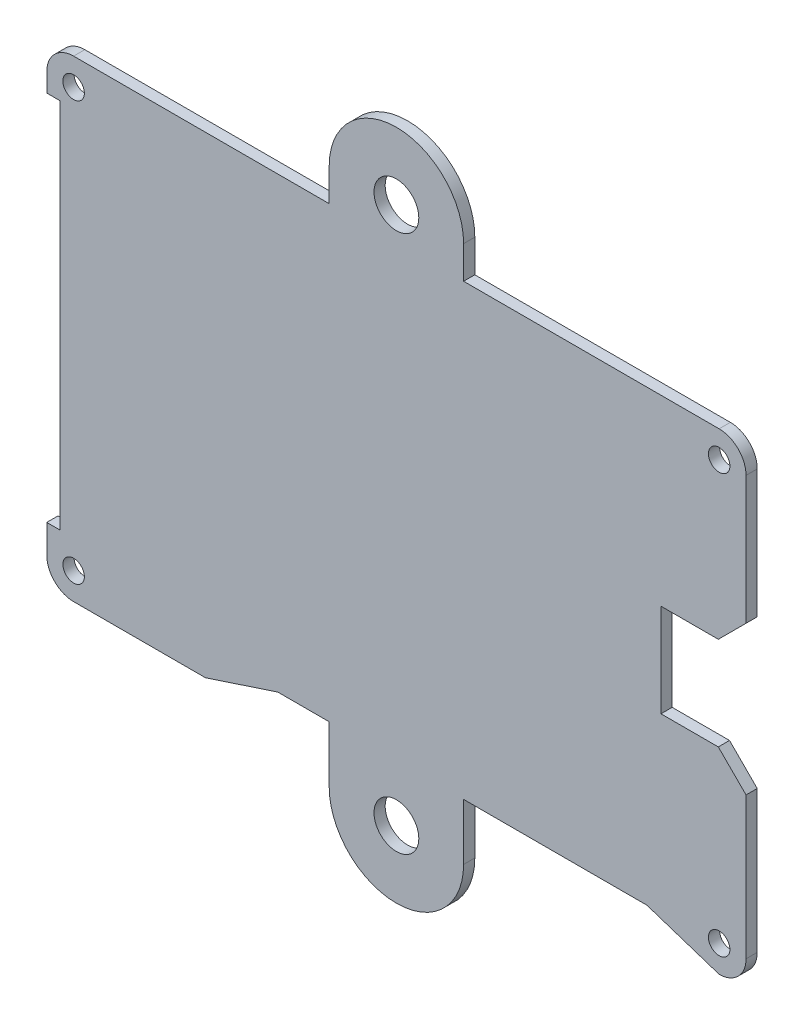
from build123d import *

# Parameters (mm, degrees)
SKETCH1_R           = 1.355900406
BOSS_EXTRUDE1_DEPTH = 1.5875
SKETCH2_R           = 3.175
BOSS_EXTRUDE2_DEPTH = 1.5875
SKETCH3_R           = 1.524
CUT_EXTRUDE1_DEPTH  = 436.184338179
SKETCH5_W           = 2.10299656
SKETCH5_H           = 13.208
BOSS_EXTRUDE3_DEPTH = 1.5875


with BuildPart() as part:
    # Sketch1 → Boss-Extrude1 (new body)
    with BuildSketch(Plane.XY):
        with BuildLine():
            Line((-301.9473, 111.74645), (-305.87795, 115.6771))
            Line((-305.87795, 115.6771), (-316.1078, 115.6771))
            Line((-316.1078, 115.6771), (-316.1078, 128.8851))
            Line((-316.1078, 128.8851), (-305.87795, 128.8851))
            Line((-305.87795, 128.8851), (-301.9473, 132.81575))
            Line((-301.9473, 132.81575), (-301.9473, 150.9704))
            ThreePointArc((-301.9473, 150.9704), (-303.063223164, 153.664476836), (-305.7573, 154.7804))
            Line((-305.7573, 154.7804), (-397.247125, 154.7804))
            ThreePointArc((-397.247125, 154.7804), (-399.946077222, 153.659592612), (-401.0571, 150.956597849))
            Line((-401.0571, 150.956597849), (-401.0571, 148.341))
            Line((-401.0571, 148.341), (-399.1521, 148.341))
            Line((-399.1521, 148.341), (-399.1521, 95.6449))
            Line((-399.1521, 95.6449), (-401.0571, 95.6449))
            Line((-401.0571, 95.6449), (-401.0571, 91.659304166))
            ThreePointArc((-401.0571, 91.659304166), (-399.951018769, 88.947400452), (-397.2472, 87.8217))
            Line((-397.2472, 87.8217), (-378.5565, 87.8217))
            Line((-378.5565, 87.8217), (-368.3165, 91.1883))
            Line((-368.3165, 91.1883), (-315.9973, 91.1883))
            Line((-315.9973, 91.1883), (-305.7573, 87.8217))
            ThreePointArc((-305.7573, 87.8217), (-303.063223164, 88.937623164), (-301.9473, 91.6317))
            Line((-301.9473, 91.6317), (-301.9473, 111.74645))
        make_face()
        with Locations((-305.7573, 91.6317)):
            Circle(SKETCH1_R, mode=Mode.SUBTRACT)
        with Locations((-305.7573, 150.9704)):
            Circle(SKETCH1_R, mode=Mode.SUBTRACT)
        with Locations((-397.247125, 150.9704)):
            Circle(SKETCH1_R, mode=Mode.SUBTRACT)
        with Locations((-397.2472, 91.6317)):
            Circle(SKETCH1_R, mode=Mode.SUBTRACT)
    extrude(amount=BOSS_EXTRUDE1_DEPTH)

    # Sketch2 → Boss-Extrude2 (add)
    # profile 1 of 2: a face of its own
    with BuildSketch(Plane.XY.offset(1.5875)):
        with BuildLine():
            Line((-361.0272, 159.40105), (-361.0272, 154.7804))
            Line((-361.0272, 154.7804), (-341.9772, 154.7804))
            Line((-341.9772, 154.7804), (-341.9772, 159.40105))
            ThreePointArc((-341.9772, 159.40105), (-351.5022, 168.92605), (-361.0272, 159.40105))
        make_face()
        with Locations((-351.5022, 159.40105)):
            Circle(SKETCH2_R, mode=Mode.SUBTRACT)
    # profile 2 of 2: a face of its own
    with BuildSketch(Plane.XY.offset(1.5875)):
        with BuildLine():
            Line((-341.9772, 91.1883), (-361.0272, 91.1883))
            Line((-361.0272, 91.1883), (-361.0272, 83.20105))
            ThreePointArc((-361.0272, 83.20105), (-351.5022, 73.67605), (-341.9772, 83.20105))
            Line((-341.9772, 83.20105), (-341.9772, 91.1883))
        make_face()
        with Locations((-351.5022, 83.20105)):
            Circle(SKETCH2_R, mode=Mode.SUBTRACT)
    extrude(amount=-BOSS_EXTRUDE2_DEPTH)

    # Sketch3 → Cut-Extrude1 (cut, through all)
    with BuildSketch(Plane.XY.offset(1.5875)):
        with Locations((-397.247125, 150.9704)):
            Circle(SKETCH3_R)
        with Locations((-305.7573, 150.9704)):
            Circle(SKETCH3_R)
        with Locations((-305.7573, 91.6317)):
            Circle(SKETCH3_R)
        with Locations((-397.2472, 91.6317)):
            Circle(SKETCH3_R)
    extrude(amount=-CUT_EXTRUDE1_DEPTH, mode=Mode.SUBTRACT)

    # Sketch5 → Boss-Extrude3 (add)
    with BuildSketch(Plane.XY.offset(1.5875)):
        with Locations((-315.05630172, 122.2811)):
            Rectangle(SKETCH5_W, SKETCH5_H)
    extrude(amount=-BOSS_EXTRUDE3_DEPTH)


solid = part.part
